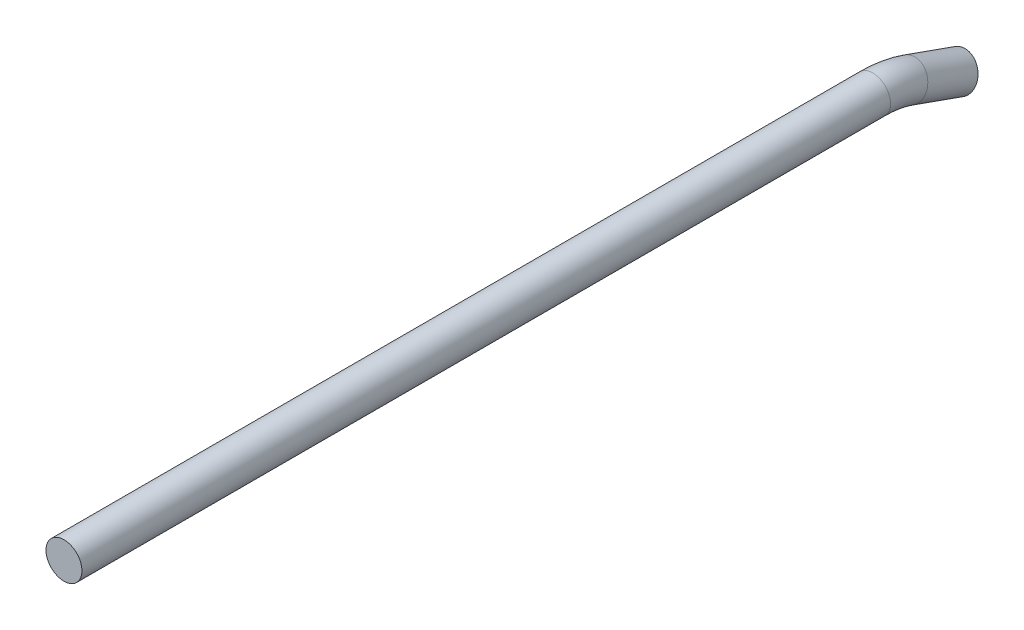
from build123d import *

# Parameters (mm, degrees)
SKETCH1_R = 0.5


with BuildPart() as part:
    # Sweep1: sweep along a path in Sketch2
    with BuildLine(Plane(origin=(0, 0, 0), x_dir=(0, 0, -1), z_dir=(1, 0, 0))) as sweep1_path:
        Line((0, 0), (22.481810022, 0))
        ThreePointArc((22.481810022, 0), (22.992438519, -0.043776305), (23.488164731, -0.173827642))
        Line((23.488164731, -0.173827642), (24.884114906, -0.67090314))
    # Sketch1 → Sweep1 (sweep)
    with BuildSketch(Plane.XY):
        Circle(SKETCH1_R)
    sweep(path=sweep1_path.line)


solid = part.part
